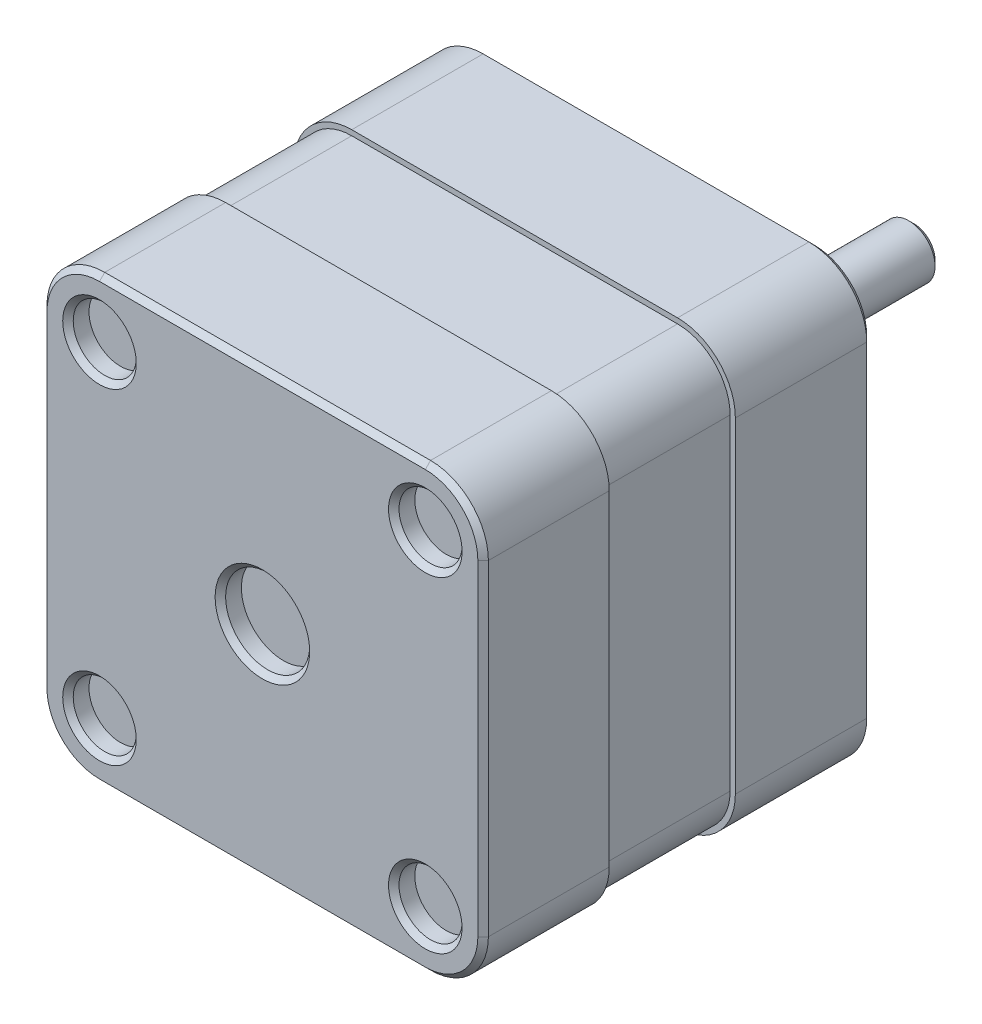
from build123d import *

# Parameters (mm, degrees)
SKETCH1_W           = 42
SKETCH1_H           = 42
BOSS_EXTRUDE1_DEPTH = 37
FILLET1_R           = 5.5
SKETCH2_R           = 4
SKETCH2_R_2         = 3
CUT_EXTRUDE1_DEPTH  = 2
SKETCH4_R           = 2.5
BOSS_EXTRUDE2_DEPTH = 25
SKETCH5_R           = 1.5
CUT_EXTRUDE2_DEPTH  = 8
CUT_EXTRUDE3_START  = -12
SKETCH6_R           = 34.308404515
CUT_EXTRUDE3_DEPTH  = 12
CHAMFER1_SIZE       = 0.5
SKETCH7_R           = 11
BOSS_EXTRUDE3_DEPTH = 1


with BuildPart() as part:
    # Sketch1 → Boss-Extrude1 (new body)
    with BuildSketch(Plane.XY):
        Rectangle(SKETCH1_W, SKETCH1_H)
    extrude(amount=BOSS_EXTRUDE1_DEPTH)

    # Fillet1
    fillet1_edges = [part.edges().sort_by_distance(p)[0] for p in [
        (21, -21, 18.5),
        (-21, -21, 18.5),
        (-21, 21, 18.5),
        (21, 21, 18.5),
    ]]
    fillet(fillet1_edges, radius=FILLET1_R)

    # Sketch2 → Cut-Extrude1 (cut)
    with BuildSketch(Plane.XY.offset(37)):
        Circle(SKETCH2_R)
        with Locations((15.5, -15.5)):
            Circle(SKETCH2_R_2)
        with Locations((15.5, 15.5)):
            Circle(SKETCH2_R_2)
        with Locations((-15.5, 15.5)):
            Circle(SKETCH2_R_2)
        with Locations((-15.5, -15.5)):
            Circle(SKETCH2_R_2)
    extrude(amount=-CUT_EXTRUDE1_DEPTH, mode=Mode.SUBTRACT)

    # Sketch4 → Boss-Extrude2 (add)
    with BuildSketch(Plane(origin=(0, 0, 0), x_dir=(-1, 0, 0), z_dir=(0, 0, -1))):
        Circle(SKETCH4_R)
    extrude(amount=BOSS_EXTRUDE2_DEPTH)

    # Sketch5 → Cut-Extrude2 (cut)
    with BuildSketch(Plane(origin=(0, 0, 0), x_dir=(-1, 0, 0), z_dir=(0, 0, -1))):
        with Locations((15.5, -15.5)):
            Circle(SKETCH5_R)
        with Locations((-15.5, -15.5)):
            Circle(SKETCH5_R)
        with Locations((15.5, 15.5)):
            Circle(SKETCH5_R)
        with Locations((-15.5, 15.5)):
            Circle(SKETCH5_R)
    extrude(amount=-CUT_EXTRUDE2_DEPTH, mode=Mode.SUBTRACT)

    # Sketch6 → Cut-Extrude3 (cut)
    # profile 1 of 2: a face of its own
    with BuildSketch(Plane.XY.offset(37).offset(CUT_EXTRUDE3_START)):
        Circle(SKETCH6_R)
        with BuildLine():
            Line((-21, 15.5), (-21, -15.5))
            ThreePointArc((-21, -15.5), (-19.389087297, -19.389087297), (-15.5, -21))
            Line((-15.5, -21), (15.5, -21))
            ThreePointArc((15.5, -21), (19.389087297, -19.389087297), (21, -15.5))
            Line((21, -15.5), (21, 15.5))
            ThreePointArc((21, 15.5), (19.389087297, 19.389087297), (15.5, 21))
            Line((15.5, 21), (-15.5, 21))
            ThreePointArc((-15.5, 21), (-19.389087297, 19.389087297), (-21, 15.5))
        make_face(mode=Mode.SUBTRACT)
    # profile 2 of 2: a face of its own
    with BuildSketch(Plane.XY.offset(37).offset(CUT_EXTRUDE3_START)):
        with BuildLine():
            ThreePointArc((-15.5, 21), (-19.389087297, 19.389087297), (-21, 15.5))
            Line((-21, 15.5), (-21, -15.5))
            ThreePointArc((-21, -15.5), (-19.389087297, -19.389087297), (-15.5, -21))
            Line((-15.5, -21), (15.5, -21))
            ThreePointArc((15.5, -21), (19.389087297, -19.389087297), (21, -15.5))
            Line((21, -15.5), (21, 15.5))
            ThreePointArc((21, 15.5), (19.389087297, 19.389087297), (15.5, 21))
            Line((15.5, 21), (-15.5, 21))
        make_face()
        with BuildLine():
            ThreePointArc((-15.5, 20.5), (-19.035533906, 19.035533906), (-20.5, 15.5))
            Line((-20.5, 15.5), (-20.5, -15.5))
            ThreePointArc((-20.5, -15.5), (-19.035533906, -19.035533906), (-15.5, -20.5))
            Line((-15.5, -20.5), (15.5, -20.5))
            ThreePointArc((15.5, -20.5), (19.035533906, -19.035533906), (20.5, -15.5))
            Line((20.5, -15.5), (20.5, 15.5))
            ThreePointArc((20.5, 15.5), (19.035533906, 19.035533906), (15.5, 20.5))
            Line((15.5, 20.5), (-15.5, 20.5))
        make_face(mode=Mode.SUBTRACT)
    extrude(amount=-CUT_EXTRUDE3_DEPTH, mode=Mode.SUBTRACT)

    # Chamfer1
    chamfer1_edges = [part.edges().sort_by_distance(p)[0] for p in [
        (0, -21, 0),
        (0, -21, 37),
        (21, 0, 0),
        (-21, 0, 0),
        (0, 21, 0),
        (-19.389087297, 19.389087297, 0),
        (19.389087297, 19.389087297, 0),
        (19.389087297, -19.389087297, 0),
        (-19.389087297, -19.389087297, 0),
        (-21, 0, 37),
        (21, 0, 37),
        (0, 21, 37),
        (-19.389087297, 19.389087297, 37),
        (19.389087297, 19.389087297, 37),
        (19.389087297, -19.389087297, 37),
        (-19.389087297, -19.389087297, 37),
        (-4, 0, 37),
        (12.5, -15.5, 37),
        (12.5, 15.5, 37),
        (-18.5, 15.5, 37),
        (-18.5, -15.5, 37),
        (2.5, 0, 0),
        (2.5, 0, -25),
        (-14, -15.5, 0),
        (17, -15.5, 0),
        (-14, 15.5, 0),
        (17, 15.5, 0),
    ]]
    chamfer(chamfer1_edges, length=CHAMFER1_SIZE)

    # Sketch7 → Boss-Extrude3 (add)
    with BuildSketch(Plane(origin=(0, 0, 0), x_dir=(-1, 0, 0), z_dir=(0, 0, -1))):
        Circle(SKETCH7_R)
    extrude(amount=BOSS_EXTRUDE3_DEPTH)


solid = part.part
